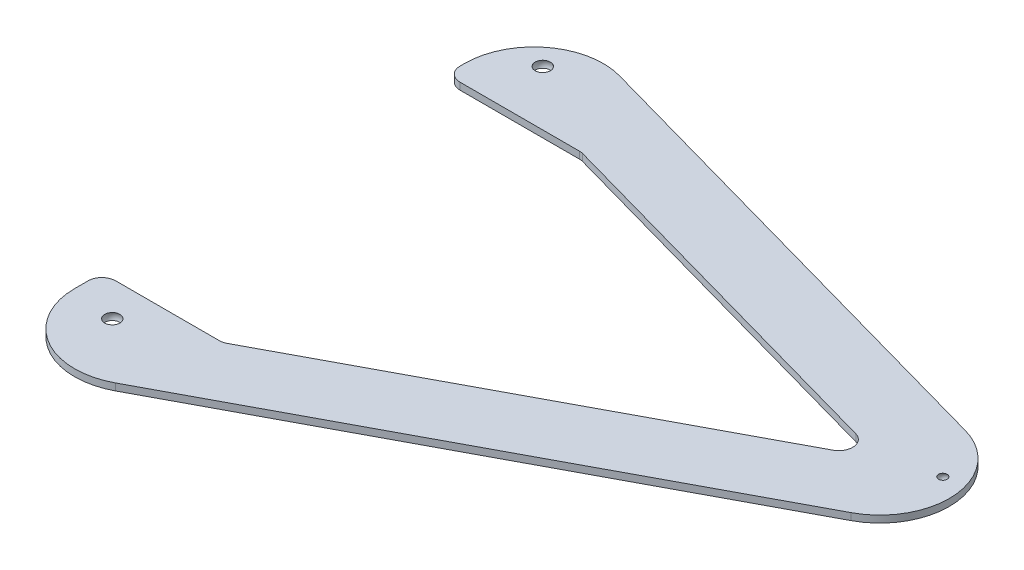
from build123d import *

# Parameters (mm, degrees)
ESTRUSIONE_ESTRUSIONE1_DEPTH = 5
SCHIZZO2_R                   = 2
TAGLIO_ESTRUSIONE1_DEPTH     = 683.260711315
RACCORDO1_R                  = 50
RACCORDO2_R                  = 50
TAGLIO_ESTRUSIONE2_DEPTH     = 609.623891467
RACCORDO3_R                  = 10
RACCORDO4_R                  = 10


with BuildPart() as part:
    # Schizzo1 → Estrusione-Estrusione1 (new body)
    with BuildSketch(Plane(origin=(0, 0, 0), x_dir=(1, 0, 0), z_dir=(0, 1, 0))):
        Polygon((0, 0), (0, 430), (529.674124537, 281.860465116), align=None)
    extrude(amount=ESTRUSIONE_ESTRUSIONE1_DEPTH)

    # Schizzo2 → Taglio-Estrusione1 (cut, through all)
    with BuildSketch(Plane(origin=(0, 5, 0), x_dir=(1, 0, 0), z_dir=(0, 1, 0))):
        with Locations((30, 390.458355286)):
            Circle(SCHIZZO2_R)
        with Locations((32.330925461, 78.068355286)):
            Circle(SCHIZZO2_R)
        with Locations((430.048420605, 278.572604758)):
            Circle(SCHIZZO2_R)
    extrude(amount=-TAGLIO_ESTRUSIONE1_DEPTH, mode=Mode.SUBTRACT)

    # Raccordo1
    raccordo1_edges = [part.edges().sort_by_distance(p)[0] for p in [
        (0, 2.5, 0),
        (0, 2.5, -430),
    ]]
    fillet(raccordo1_edges, radius=RACCORDO1_R)


with BuildPart() as body_2:
    # Schizzo4 → Rivoluzione1 (revolve)
    with BuildSketch(Plane(origin=(0, 2.5, 0), x_dir=(-1, 0, 0), z_dir=(0, -1, 0))):
        with BuildLine():
            Line((-27.302636704, 385.098856126), (-32.697363296, 395.817854447))
            ThreePointArc((-32.697363296, 395.817854447), (-24.640500839, 393.155718582), (-27.302636704, 385.098856126))
        make_face()
    revolve(axis=Axis((27.302636704, 2.5, -385.098856126), (0.4495605492633998, 0, -0.8932498600873052)))


with BuildPart() as body_3:
    # Schizzo5 → Rivoluzione2 (revolve)
    with BuildSketch(Plane(origin=(0, 2.5, 0), x_dir=(-1, 0, 0), z_dir=(0, -1, 0))):
        with BuildLine():
            Line((-431.410782336, 282.333451805), (-428.686058875, 274.81175771))
            ThreePointArc((-428.686058875, 274.81175771), (-433.809267653, 277.210243027), (-431.410782336, 282.333451805))
        make_face()
    revolve(axis=Axis((431.410782336, 2.5, -282.333451805), (-0.3405904326176957, 0, 0.9402117618969096)))


with BuildPart() as body_4:
    # Schizzo6 → Rivoluzione3 (revolve)
    with BuildSketch(Plane(origin=(0, 2.5, 0), x_dir=(-1, 0, 0), z_dir=(0, -1, 0))):
        with BuildLine():
            Line((-32.330925461, 84.068355286), (-32.330925461, 72.068355286))
            ThreePointArc((-32.330925461, 72.068355286), (-38.330925461, 78.068355286), (-32.330925461, 84.068355286))
        make_face()
    revolve(axis=Axis((32.330925461, 2.5, -84.068355286), (0, 0, 1)))


with BuildPart() as part_1:
    add(part.part)

    # Abbina1: cut body 4, body 3, body 2
    add(body_4.part, mode=Mode.SUBTRACT)
    add(body_3.part, mode=Mode.SUBTRACT)
    add(body_2.part, mode=Mode.SUBTRACT)

    # Raccordo2
    raccordo2_edges = [part_1.edges().sort_by_distance(p)[0] for p in [
        (529.674124537, 2.5, -281.860465116),
    ]]
    fillet(raccordo2_edges, radius=RACCORDO2_R)

    # Schizzo7 → Taglio-Estrusione2 (cut, through all)
    with BuildSketch(Plane(origin=(0, 5, 0), x_dir=(1, 0, 0), z_dir=(0, 1, 0))):
        Polygon((97.409596838, 350.837718087), (395.953194305, 267.340889334), (86.976621658, 102.922284683), (-31.439273143, 102.922284683), (-31.439273143, 350.837718087), align=None)
    extrude(amount=-TAGLIO_ESTRUSIONE2_DEPTH, mode=Mode.SUBTRACT)

    # Raccordo3
    raccordo3_edges = [part_1.edges().sort_by_distance(p)[0] for p in [
        (0, 2.5, -102.922284683),
        (0, 2.5, -350.837718087),
        (86.976621658, 2.5, -102.922284683),
        (97.409596838, 2.5, -350.837718087),
    ]]
    fillet(raccordo3_edges, radius=RACCORDO3_R)

    # Raccordo4
    raccordo4_edges = [part_1.edges().sort_by_distance(p)[0] for p in [
        (395.953194305, 2.5, -267.340889334),
    ]]
    fillet(raccordo4_edges, radius=RACCORDO4_R)


solid = part_1.part
